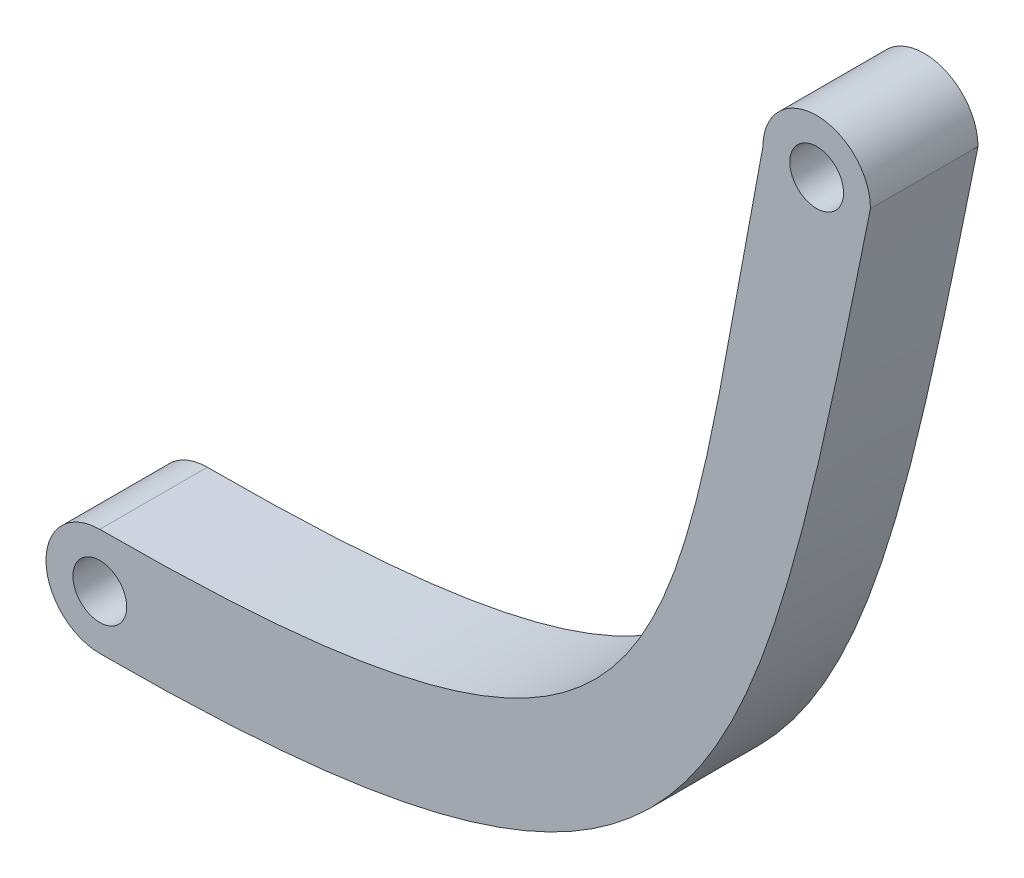
from build123d import *

# Parameters (mm, degrees)
BOSS_EXTRU_1_DEPTH      = 3
BOSS_EXTRU_1_DEPTH_BACK = 3
ESQUISSE1_R             = 1.5


with BuildPart() as part:
    # Esquisse1 → Boss.-Extru.1 (new, two sides: drawn at the far end of the back side and taken through both)
    with BuildSketch(Plane.XY.offset(-BOSS_EXTRU_1_DEPTH_BACK)):
        with BuildLine():
            ThreePointArc((0, 3), (-3, 0), (0, -3))
            add(Edge.make_bspline(
                [(0, -3), (34.547376403, -3), (36.359532073, 7.334799912), (43, 40)],
                knots=[0, 0, 0, 0, 1, 1, 1, 1], degree=3))
            ThreePointArc((43, 40), (40, 43), (37, 40))
            add(Edge.make_bspline(
                [(0, 3), (33.333333333, 3), (31.664729171, 12.359061598), (37, 40)],
                knots=[0, 0, 0, 0, 1, 1, 1, 1], degree=3))
        make_face()
        Circle(ESQUISSE1_R, mode=Mode.SUBTRACT)
        with Locations((40, 40)):
            Circle(ESQUISSE1_R, mode=Mode.SUBTRACT)
    extrude(amount=BOSS_EXTRU_1_DEPTH + BOSS_EXTRU_1_DEPTH_BACK)


solid = part.part
